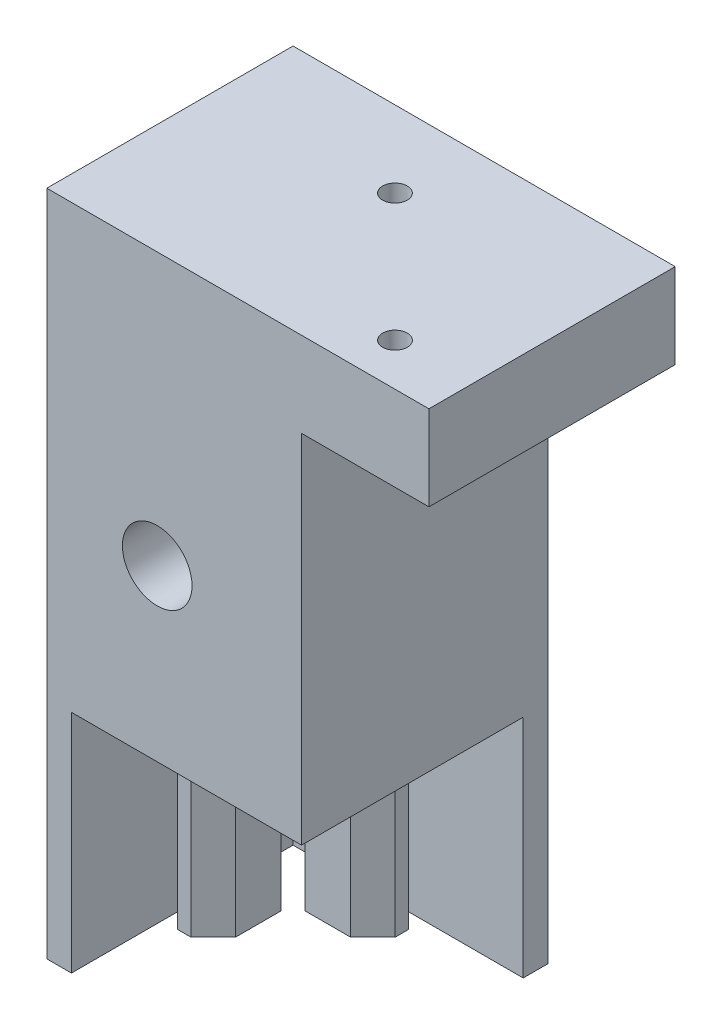
from build123d import *

# Parameters (mm, degrees)
SKETCH_1_W          = 30
SKETCH_1_H          = 23
EXTRUDE_1_DEPTH     = 72
SKETCH_2_W          = 27
SKETCH_2_H          = 20
CUT_EXTRUDE_1_DEPTH = 20
SKETCH_3_R          = 4.1
CUT_EXTRUDE_2_DEPTH = 6
SKETCH_7_W          = 15
SKETCH_7_H          = 10
EXTRUDE_2_DEPTH     = 23
EXTRUDE_3_DEPTH     = 20
EXTRUDE_START       = 6
SKETCH_11_R         = 4.1
EXTRUDE_5_DEPTH     = 6
SKETCH_12_R         = 1.45
CUT_EXTRUDE_3_DEPTH = 5
SKETCH_13_R         = 1.45
CUT_EXTRUDE_4_DEPTH = 1.5
SKETCH_14_W         = 7.1
SKETCH_14_H         = 0.1
SKETCH_14_W_2       = 14.1
SKETCH_14_W_3       = 0.1
SKETCH_14_H_2       = 13.1
CUT_EXTRUDE_5_DEPTH = 20
EXTRUDE_6_DEPTH     = 6.6


with BuildPart() as part:
    # 草图1 → 凸台-拉伸1 (new body)
    with BuildSketch(Plane(origin=(0, 0, 0), x_dir=(1, 0, 0), z_dir=(0, 1, 0))):
        with Locations((15, 11.5)):
            Rectangle(SKETCH_1_W, SKETCH_1_H)
    extrude(amount=EXTRUDE_1_DEPTH)

    # 草图2 → 切除-拉伸1 (cut)
    with BuildSketch(Plane.XZ):
        with Locations((16.5, -10)):
            Rectangle(SKETCH_2_W, SKETCH_2_H)
    extrude(amount=-CUT_EXTRUDE_1_DEPTH, mode=Mode.SUBTRACT)

    # 草图3 → 切除-拉伸2 (cut)
    with BuildSketch(Plane.XY):
        with Locations((13, 40)):
            Circle(SKETCH_3_R)
    extrude(amount=-CUT_EXTRUDE_2_DEPTH, mode=Mode.SUBTRACT)

    # 草图7 → 凸台-拉伸2 (add)
    with BuildSketch(Plane(origin=(0, 0, -23), x_dir=(-1, 0, 0), z_dir=(0, 0, -1))):
        with Locations((-37.5, 67)):
            Rectangle(SKETCH_7_W, SKETCH_7_H)
    extrude(amount=-EXTRUDE_2_DEPTH)

    # 草图9 → 凸台-拉伸3 (add)
    with BuildSketch(Plane.XZ.offset(-20)):
        Polygon((10.1, -20), (15.9, -20), (15.9, -18.3), (18.3, -18.3), (18.3, -16.732842713), (15.667157288, -14.1), (10.332842713, -14.1), (7.7, -16.732842713), (7.7, -18.3), (10.1, -18.3), align=None)
    extrude_3 = extrude(amount=EXTRUDE_3_DEPTH)

    # 镜向1: 凸台-拉伸3 across plane
    add(extrude_3.mirror(Plane(origin=(11.5, 0, -11.5), x_dir=(0.7071067811865478, 0, 0.7071067811865472), z_dir=(0.7071067811865475, 0, -0.7071067811865477))))

    # 草图11 → 凸台-拉伸5 (add)
    with BuildSketch(Plane.XY.offset(EXTRUDE_START)):
        Polygon((0, 0), (3, 0), (3, 20), (30, 20), (30, 62), (45, 62), (45, 72), (0, 72), align=None)
        with Locations((13, 40)):
            Circle(SKETCH_11_R, mode=Mode.SUBTRACT)
    extrude(amount=-EXTRUDE_5_DEPTH)

    # 草图12 → 切除-拉伸3 (cut)
    with BuildSketch(Plane(origin=(0, 72, 0), x_dir=(1, 0, 0), z_dir=(0, 1, 0))):
        with Locations(Location((21, 14, 0), (0, 0, 270))):
            Circle(SKETCH_12_R)
        with Locations(Location((36, -1, 0), (0, 0, 270))):
            Circle(SKETCH_12_R)
    extrude(amount=-CUT_EXTRUDE_3_DEPTH, mode=Mode.SUBTRACT)

    # 草图13 → 切除-拉伸4 (cut)
    with BuildSketch(Plane(origin=(0, 67, 0), x_dir=(1, 0, 0), z_dir=(0, 1, 0))):
        with Locations(Location((21, 14, 0), (0, 0, 270))):
            Circle(SKETCH_13_R)
    extrude(amount=-CUT_EXTRUDE_4_DEPTH, mode=Mode.SUBTRACT)

    # 草图14 → 切除-拉伸5 (cut)
    with BuildSketch(Plane.XZ):
        with Locations((6.55, -20.05)):
            Rectangle(SKETCH_14_W, SKETCH_14_H)
        Polygon((3, -12.9), (2.9, -12.9), (2.9, -20.1), (3, -20.1), (3, -20), align=None)
        with Locations((22.95, -20.05)):
            Rectangle(SKETCH_14_W_2, SKETCH_14_H)
        with Locations((2.95, -0.55)):
            Rectangle(SKETCH_14_W_3, SKETCH_14_H_2)
    extrude(amount=-CUT_EXTRUDE_5_DEPTH, mode=Mode.SUBTRACT)

    # 草图15 → 凸台-拉伸6 (add)
    with BuildSketch(Plane.XZ):
        Polygon((4.7, -7.1), (2.9, -7.1), (2.9, 6), (0, 6), (0, -23), (30, -23), (30, -20.1), (15.9, -20.1), (15.9, -18.3), (18.3, -18.3), (18.3, -16.732842713), (15.667157288, -14.1), (10.332842713, -14.1), (7.7, -16.732842713), (7.7, -18.3), (10.1, -18.3), (10.1, -20.1), (2.9, -20.1), (2.9, -12.9), (4.7, -12.9), (4.7, -15.3), (6.267157287, -15.3), (8.9, -12.667157287), (8.9, -7.332842712), (6.267157287, -4.7), (4.7, -4.7), align=None)
    extrude(amount=EXTRUDE_6_DEPTH)


solid = part.part
